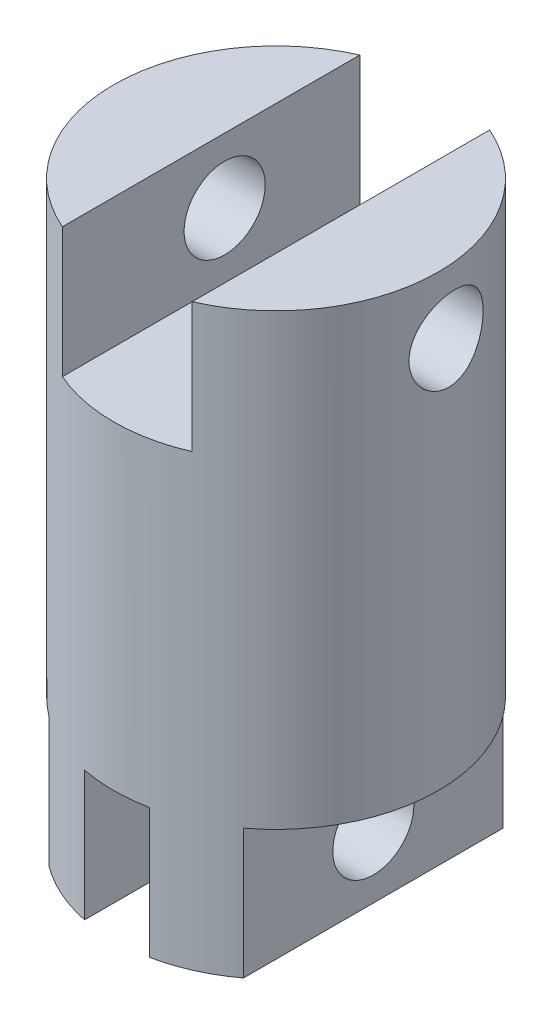
from build123d import *

# Parameters (mm, degrees)
SKETCH1_R               = 12.7
BOSS_EXTRUDE1_DEPTH     = 45.3136
CUT_EXTRUDE1_START      = -10.16
CUT_EXTRUDE1_DEPTH      = 10.16
CUT_EXTRUDE2_DEPTH      = 10.16
CUT_EXTRUDE3_DEPTH      = 51.306468222
CUT_EXTRUDE3_DEPTH_BACK = 51.306468222
SKETCH4_R               = 3.175
SKETCH5_R               = 2.54
CUT_EXTRUDE4_DEPTH      = 40.476013035


with BuildPart() as part:
    # Sketch1 → Boss-Extrude1 (new body)
    with BuildSketch(Plane(origin=(0, 0, 0), x_dir=(1, 0, 0), z_dir=(0, 1, 0))):
        with Locations(Location((0, 0, 0), (0, 0, 90))):
            Circle(SKETCH1_R)
    extrude(amount=BOSS_EXTRUDE1_DEPTH)

    # Sketch2 → Cut-Extrude1 (cut)
    with BuildSketch(Plane(origin=(0, 45.3136, 0), x_dir=(1, 0, 0), z_dir=(0, 1, 0)).offset(CUT_EXTRUDE1_START)):
        with BuildLine():
            Line((5.08, 11.639742265), (5.08, -11.639742265))
            ThreePointArc((5.08, -11.639742265), (0, -12.7), (-5.08, -11.639742265))
            Line((-5.08, -11.639742265), (-5.08, 11.639742265))
            ThreePointArc((-5.08, 11.639742265), (0, 12.7), (5.08, 11.639742265))
        make_face()
    extrude(amount=CUT_EXTRUDE1_DEPTH, mode=Mode.SUBTRACT)

    # Sketch3 → Cut-Extrude2 (cut)
    with BuildSketch(Plane.XZ):
        with BuildLine():
            Line((-2.54, 12.443407893), (-2.54, -12.443407893))
            ThreePointArc((-2.54, -12.443407893), (0, -12.7), (2.54, -12.443407893))
            Line((2.54, -12.443407893), (2.54, 12.443407893))
            ThreePointArc((2.54, 12.443407893), (0, 12.7), (-2.54, 12.443407893))
        make_face()
        with BuildLine():
            Line((-7.62, 10.16), (-7.62, -10.16))
            ThreePointArc((-7.62, -10.16), (-12.7, 0), (-7.62, 10.16))
        make_face()
        with BuildLine():
            Line((7.62, 10.16), (7.62, -10.16))
            ThreePointArc((7.62, -10.16), (12.7, 0), (7.62, 10.16))
        make_face()
    extrude(amount=-CUT_EXTRUDE2_DEPTH, mode=Mode.SUBTRACT)

    # Sketch4 → Cut-Extrude3 (cut, two sides: drawn at the far end of the back side and taken through both)
    with BuildSketch(Plane(origin=(-5.08, 0, 0), x_dir=(0, 0, -1), z_dir=(1, 0, 0)).offset(-CUT_EXTRUDE3_DEPTH_BACK)):
        with Locations((1.060257735, 40.2336)):
            Circle(SKETCH4_R)
        with Locations((0, 5.08)):
            Circle(SKETCH4_R)
    extrude(amount=CUT_EXTRUDE3_DEPTH + CUT_EXTRUDE3_DEPTH_BACK, mode=Mode.SUBTRACT)

    # Sketch5 → Cut-Extrude4 (cut, through all)
    with BuildSketch(Plane(origin=(0, 35.1536, 0), x_dir=(1, 0, 0), z_dir=(0, 1, 0))):
        with Locations(Location((0, 0, 0), (0, 0, 270))):
            Circle(SKETCH5_R)
    extrude(amount=-CUT_EXTRUDE4_DEPTH, mode=Mode.SUBTRACT)


solid = part.part
